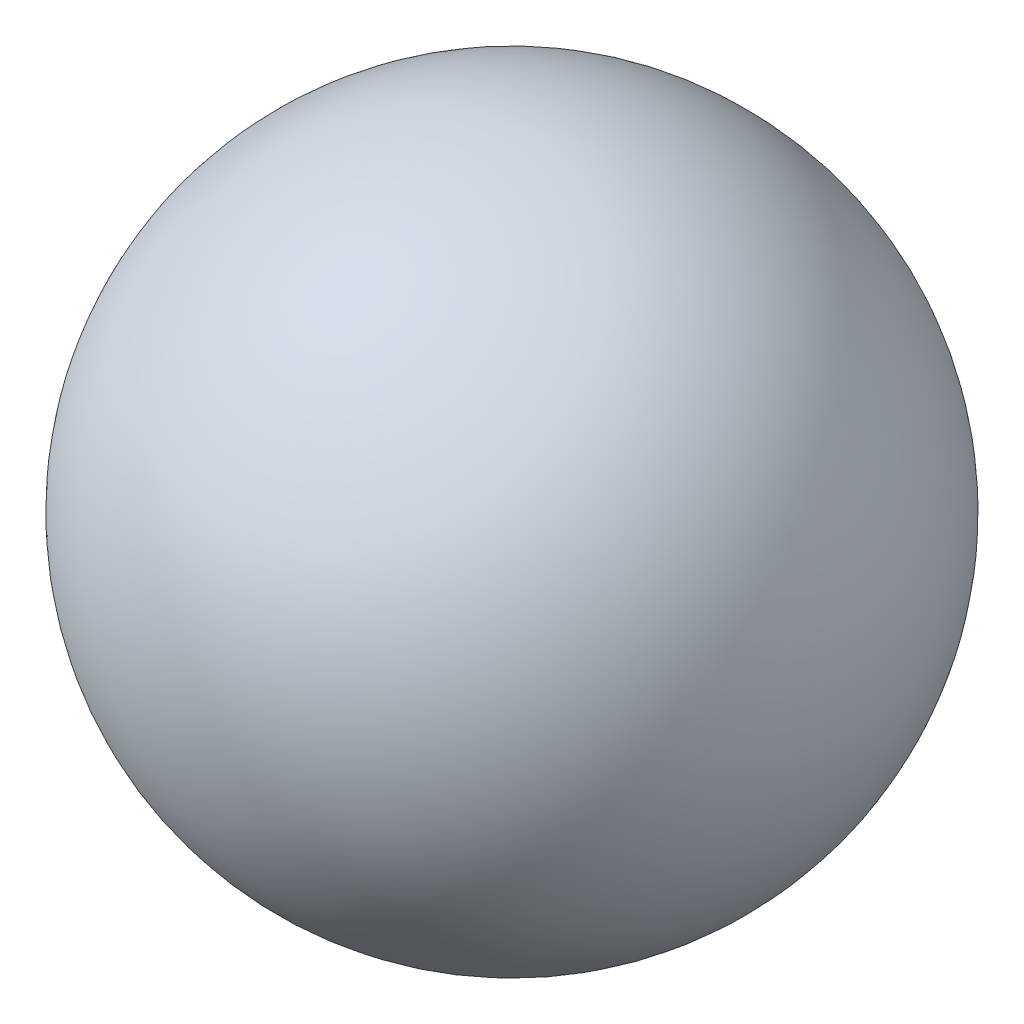
from build123d import *


with BuildPart() as part:
    # Sketch1 → Revolve1 (revolve)
    with BuildSketch(Plane.XY):
        with BuildLine():
            Line((-3.692307692, 0), (3.692307692, 0))
            ThreePointArc((3.692307692, 0), (0, -3.692307692), (-3.692307692, 0))
        make_face()
    revolve(axis=Axis((0, 0, 0), (1, 0, 0)))


solid = part.part
